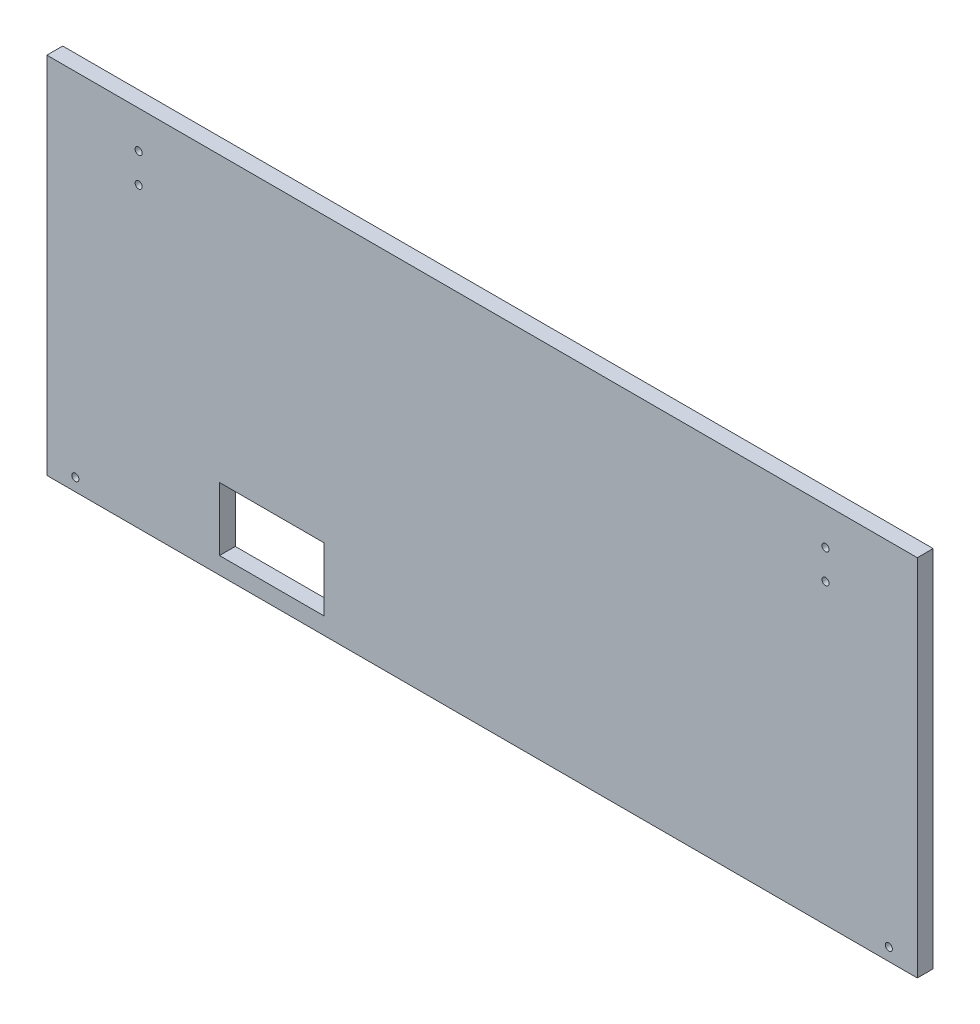
from build123d import *

# Parameters (mm, degrees)
SCHIZZO1_W                   = 550
SCHIZZO1_H                   = 230
ESTRUSIONE_ESTRUSIONE1_DEPTH = 10
SCHIZZO2_R                   = 2.25
SCHIZZO2_W                   = 66
SCHIZZO2_H                   = 40
TAGLIO_ESTRUSIONE1_DEPTH     = 10


with BuildPart() as part:
    # Schizzo1 → Estrusione-Estrusione1 (new body)
    with BuildSketch(Plane.XY):
        Rectangle(SCHIZZO1_W, SCHIZZO1_H)
    extrude(amount=ESTRUSIONE_ESTRUSIONE1_DEPTH)

    # Schizzo2 → Taglio-Estrusione1 (cut)
    with BuildSketch(Plane(origin=(0, 0, 0), x_dir=(-1, 0, 0), z_dir=(0, 0, -1))):
        with Locations((-217, 91.5)):
            Circle(SCHIZZO2_R)
        with Locations((-217, 73)):
            Circle(SCHIZZO2_R)
        with Locations((217, 91.5)):
            Circle(SCHIZZO2_R)
        with Locations((217, 73)):
            Circle(SCHIZZO2_R)
        with Locations((-257, -107)):
            Circle(SCHIZZO2_R)
        with Locations((257, -107)):
            Circle(SCHIZZO2_R)
        with Locations((132.925688, -84.3)):
            Rectangle(SCHIZZO2_W, SCHIZZO2_H)
    extrude(amount=-TAGLIO_ESTRUSIONE1_DEPTH, mode=Mode.SUBTRACT)


solid = part.part
